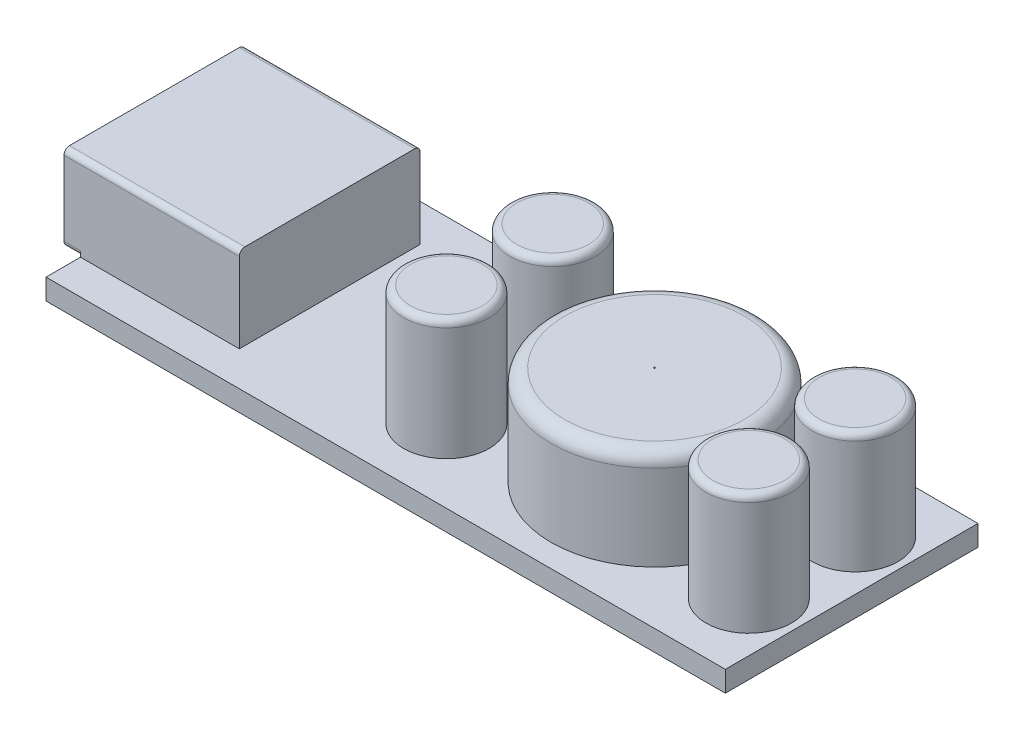
from build123d import *

# Parameters (mm, degrees)
SKETCH_1_W          = 49.2
SKETCH_1_H          = 18.3
EXTRUDE_361_DEPTH   = 1.5
SKETCH_3_W          = 12.7
SKETCH_3_H          = 13.1
EXTRUDE_2_DEPTH     = 6.2
SKETCH_4_W          = 7.2
SKETCH_4_H          = 8.8
EXTRUDE_3_DEPTH     = 3.5
FILLET_2_R          = 1
FILLET_3_R          = 0.4
SKETCH_5_R          = 3.1
EXTRUDE_4_DEPTH     = 8.7
FILLET_5_R          = 0.5
SKETCH_6_R          = 7.5
SKETCH_6_R_2        = 0.053550992
EXTRUDE_5_DEPTH     = 7.2
FILLET_6_R          = 1
SKETCH_7_W          = 12.5
SKETCH_7_H          = 5
CUT_EXTRUDE_1_DEPTH = 10.2
FILLET_7_R          = 0.4


with BuildPart() as part:
    # Эскиз1 → Extrude 361 (new body)
    with BuildSketch(Plane(origin=(0, 0, 0), x_dir=(1, 0, 0), z_dir=(0, 1, 0))):
        Rectangle(SKETCH_1_W, SKETCH_1_H)
    extrude(amount=EXTRUDE_361_DEPTH)

    # Эскиз3 → Бобышка-Вытянуть2 (add)
    with BuildSketch(Plane(origin=(0, 1.5, 0), x_dir=(1, 0, 0), z_dir=(0, 1, 0))):
        with Locations((-19.45, -0.1)):
            Rectangle(SKETCH_3_W, SKETCH_3_H)
    extrude(amount=EXTRUDE_2_DEPTH)

    # Эскиз4 → Бобышка-Вытянуть3 (add)
    with BuildSketch(Plane.XZ):
        with Locations((-21, 0)):
            Rectangle(SKETCH_4_W, SKETCH_4_H)
    extrude(amount=EXTRUDE_3_DEPTH)

    # Скругление2
    fillet_2_edges = [part.edges().sort_by_distance(p)[0] for p in [
        (-21, -3.5, 4.4),
        (-21, -3.5, -4.4),
    ]]
    fillet(fillet_2_edges, radius=FILLET_2_R)

    # Скругление3
    fillet_3_edges = [part.edges().sort_by_distance(p)[0] for p in [
        (-19.45, 7.7, -6.45),
        (-19.45, 7.7, 6.65),
    ]]
    fillet(fillet_3_edges, radius=FILLET_3_R)

    # Эскиз5 → Бобышка-Вытянуть4 (add)
    with BuildSketch(Plane(origin=(0, 1.5, 0), x_dir=(1, 0, 0), z_dir=(0, 1, 0))):
        with Locations(Location((21, 3.85, 0), (0, 0, 270))):
            Circle(SKETCH_5_R)
        with Locations(Location((21, -3.85, 0), (0, 0, 270))):
            Circle(SKETCH_5_R)
        with Locations(Location((-0.9, -3.85, 0), (0, 0, 270))):
            Circle(SKETCH_5_R)
        with Locations(Location((-0.9, 3.85, 0), (0, 0, 270))):
            Circle(SKETCH_5_R)
    extrude(amount=EXTRUDE_4_DEPTH)

    # Скругление5
    fillet_5_edges = [part.edges().sort_by_distance(p)[0] for p in [
        (21, 10.2, -6.95),
        (21, 10.2, 0.75),
        (-0.9, 10.2, 0.75),
        (-0.9, 10.2, -6.95),
    ]]
    fillet(fillet_5_edges, radius=FILLET_5_R)

    # Эскиз6 → Бобышка-Вытянуть5 (add)
    with BuildSketch(Plane(origin=(0, 1.5, 0), x_dir=(1, 0, 0), z_dir=(0, 1, 0))):
        with Locations(Location((10.324402455, 0, 0), (0, 0, 270))):
            Circle(SKETCH_6_R)
        with Locations(Location((10.324402455, 0, 0), (0, 0, 270))):
            Circle(SKETCH_6_R_2, mode=Mode.SUBTRACT)
    extrude(amount=EXTRUDE_5_DEPTH)

    # Скругление6
    fillet_6_edges = [part.edges().sort_by_distance(p)[0] for p in [
        (10.324402455, 8.7, -7.5),
    ]]
    fillet(fillet_6_edges, radius=FILLET_6_R)

    # Эскиз7 → Вырез-Вытянуть1 (cut)
    with BuildSketch(Plane.ZY.offset(25.8)):
        with Locations((0.078486032, 4.347326387)):
            Rectangle(SKETCH_7_W, SKETCH_7_H)
    extrude(amount=-CUT_EXTRUDE_1_DEPTH, mode=Mode.SUBTRACT)

    # Скругление7
    fillet_7_edges = [part.edges().sort_by_distance(p)[0] for p in [
        (-25.2, 1.5, -6.45),
        (-25.2, 1.5, 6.65),
    ]]
    fillet(fillet_7_edges, radius=FILLET_7_R)


solid = part.part
